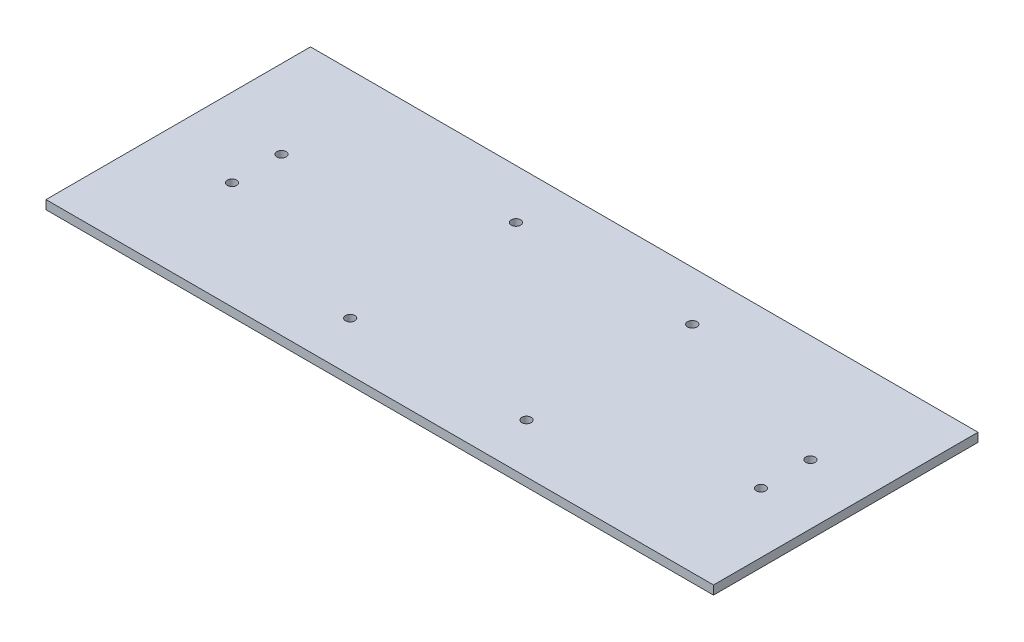
from build123d import *

# Parameters (mm, degrees)
SKETCH1_W           = 378.54
SKETCH1_H           = 150
SKETCH1_R           = 2.65
BOSS_EXTRUDE1_DEPTH = 5


with BuildPart() as part:
    # Sketch1 → Boss-Extrude1 (new body)
    with BuildSketch(Plane(origin=(0, 0, 0), x_dir=(1, 0, 0), z_dir=(0, 1, 0))):
        with Locations((189.27, 83.5)):
            Rectangle(SKETCH1_W, SKETCH1_H)
        with Locations(Location((344.5, 69.5, 0), (0, 0, 270))):
            Circle(SKETCH1_R, mode=Mode.SUBTRACT)
        with Locations(Location((144.5, 36.5, 0), (0, 0, 270))):
            Circle(SKETCH1_R, mode=Mode.SUBTRACT)
        with Locations(Location((244.5, 36.5, 0), (0, 0, 270))):
            Circle(SKETCH1_R, mode=Mode.SUBTRACT)
        with Locations(Location((344.5, 97.5, 0), (0, 0, 90))):
            Circle(SKETCH1_R, mode=Mode.SUBTRACT)
        with Locations(Location((44.5, 69.5, 0), (0, 0, 270))):
            Circle(SKETCH1_R, mode=Mode.SUBTRACT)
        with Locations(Location((244.5, 130.5, 0), (0, 0, 90))):
            Circle(SKETCH1_R, mode=Mode.SUBTRACT)
        with Locations(Location((144.5, 130.5, 0), (0, 0, 90))):
            Circle(SKETCH1_R, mode=Mode.SUBTRACT)
        with Locations(Location((44.5, 97.5, 0), (0, 0, 90))):
            Circle(SKETCH1_R, mode=Mode.SUBTRACT)
    extrude(amount=BOSS_EXTRUDE1_DEPTH)


solid = part.part
